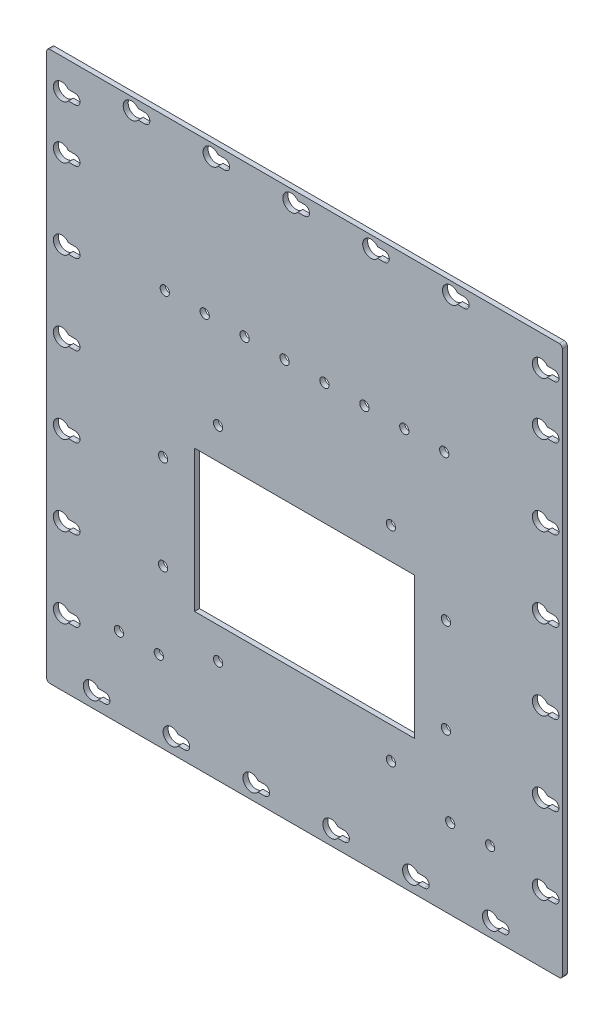
from build123d import *

# Parameters (mm, degrees)
SKETCH1_W                = 164.1
SKETCH1_H                = 174.745
BOSS_EXTRUDE1_DEPTH      = 1.5875
FILLET1_R                = 1
SKETCH2_R                = 1.4732
CUT_EXTRUDE1_DEPTH       = 10
HEAT_STRAP_CONNECTIONS_R = 1.4732
CUT_EXTRUDE2_DEPTH       = 241.065605994


with BuildPart() as part:
    # Sketch1 → Boss-Extrude1 (new body)
    with BuildSketch(Plane.XY):
        with Locations((82.55, -87.3725)):
            Rectangle(SKETCH1_W, SKETCH1_H)
        with BuildLine():
            Line((82.55, -5.4375), (80.434372699, -5.4375))
            ThreePointArc((80.434372699, -5.4375), (75.6625, -3.85), (80.434372699, -2.2625))
            Line((80.434372699, -2.2625), (82.55, -2.2625))
            ThreePointArc((82.55, -2.2625), (84.1375, -3.85), (82.55, -5.4375))
        make_face(mode=Mode.SUBTRACT)
        with BuildLine():
            Line((16.934372699, -168.395), (19.05, -168.395))
            ThreePointArc((19.05, -168.395), (20.6375, -169.9825), (19.05, -171.57))
            Line((19.05, -171.57), (16.934372699, -171.57))
            ThreePointArc((16.934372699, -171.57), (12.1625, -169.9825), (16.934372699, -168.395))
        make_face(mode=Mode.SUBTRACT)
        with BuildLine():
            Line((7.409372699, -151.9325), (9.525, -151.9325))
            ThreePointArc((9.525, -151.9325), (11.1125, -153.52), (9.525, -155.1075))
            Line((9.525, -155.1075), (7.409372699, -155.1075))
            ThreePointArc((7.409372699, -155.1075), (2.6375, -153.52), (7.409372699, -151.9325))
        make_face(mode=Mode.SUBTRACT)
        with BuildLine():
            Line((42.334372699, -168.395), (44.45, -168.395))
            ThreePointArc((44.45, -168.395), (46.0375, -169.9825), (44.45, -171.57))
            Line((44.45, -171.57), (42.334372699, -171.57))
            ThreePointArc((42.334372699, -171.57), (37.5625, -169.9825), (42.334372699, -168.395))
        make_face(mode=Mode.SUBTRACT)
        with BuildLine():
            Line((67.734372699, -168.395), (69.85, -168.395))
            ThreePointArc((69.85, -168.395), (71.4375, -169.9825), (69.85, -171.57))
            Line((69.85, -171.57), (67.734372699, -171.57))
            ThreePointArc((67.734372699, -171.57), (62.9625, -169.9825), (67.734372699, -168.395))
        make_face(mode=Mode.SUBTRACT)
        with BuildLine():
            Line((7.409372699, -126.5325), (9.525, -126.5325))
            ThreePointArc((9.525, -126.5325), (11.1125, -128.12), (9.525, -129.7075))
            Line((9.525, -129.7075), (7.409372699, -129.7075))
            ThreePointArc((7.409372699, -129.7075), (2.6375, -128.12), (7.409372699, -126.5325))
        make_face(mode=Mode.SUBTRACT)
        with BuildLine():
            Line((7.409372699, -101.1325), (9.525, -101.1325))
            ThreePointArc((9.525, -101.1325), (11.1125, -102.72), (9.525, -104.3075))
            Line((9.525, -104.3075), (7.409372699, -104.3075))
            ThreePointArc((7.409372699, -104.3075), (2.6375, -102.72), (7.409372699, -101.1325))
        make_face(mode=Mode.SUBTRACT)
        with BuildLine():
            Line((7.409372699, -75.7325), (9.525, -75.7325))
            ThreePointArc((9.525, -75.7325), (11.1125, -77.32), (9.525, -78.9075))
            Line((9.525, -78.9075), (7.409372699, -78.9075))
            ThreePointArc((7.409372699, -78.9075), (2.6375, -77.32), (7.409372699, -75.7325))
        make_face(mode=Mode.SUBTRACT)
        with BuildLine():
            Line((7.409372699, -50.3325), (9.525, -50.3325))
            ThreePointArc((9.525, -50.3325), (11.1125, -51.92), (9.525, -53.5075))
            Line((9.525, -53.5075), (7.409372699, -53.5075))
            ThreePointArc((7.409372699, -53.5075), (2.6375, -51.92), (7.409372699, -50.3325))
        make_face(mode=Mode.SUBTRACT)
        with BuildLine():
            Line((7.409372699, -24.9325), (9.525, -24.9325))
            ThreePointArc((9.525, -24.9325), (11.1125, -26.52), (9.525, -28.1075))
            Line((9.525, -28.1075), (7.409372699, -28.1075))
            ThreePointArc((7.409372699, -28.1075), (2.6375, -26.52), (7.409372699, -24.9325))
        make_face(mode=Mode.SUBTRACT)
        with BuildLine():
            Line((7.409372699, -8.1), (9.525, -8.1))
            ThreePointArc((9.525, -8.1), (11.1125, -9.6875), (9.525, -11.275))
            Line((9.525, -11.275), (7.409372699, -11.275))
            ThreePointArc((7.409372699, -11.275), (2.6375, -9.6875), (7.409372699, -8.1))
        make_face(mode=Mode.SUBTRACT)
        with BuildLine():
            Line((29.634372699, -2.2625), (31.75, -2.2625))
            ThreePointArc((31.75, -2.2625), (33.3375, -3.85), (31.75, -5.4375))
            Line((31.75, -5.4375), (29.634372699, -5.4375))
            ThreePointArc((29.634372699, -5.4375), (24.8625, -3.85), (29.634372699, -2.2625))
        make_face(mode=Mode.SUBTRACT)
        with BuildLine():
            Line((55.034372699, -2.2625), (57.15, -2.2625))
            ThreePointArc((57.15, -2.2625), (58.7375, -3.85), (57.15, -5.4375))
            Line((57.15, -5.4375), (55.034372699, -5.4375))
            ThreePointArc((55.034372699, -5.4375), (50.2625, -3.85), (55.034372699, -2.2625))
        make_face(mode=Mode.SUBTRACT)
        with BuildLine():
            ThreePointArc((161.925, -8.1), (163.5125, -9.6875), (161.925, -11.275))
            Line((161.925, -11.275), (159.809372699, -11.275))
            ThreePointArc((159.809372699, -11.275), (155.0375, -9.6875), (159.809372699, -8.1))
            Line((159.809372699, -8.1), (161.925, -8.1))
        make_face(mode=Mode.SUBTRACT)
        with BuildLine():
            Line((93.134372699, -168.395), (95.25, -168.395))
            ThreePointArc((95.25, -168.395), (96.8375, -169.9825), (95.25, -171.57))
            Line((95.25, -171.57), (93.134372699, -171.57))
            ThreePointArc((93.134372699, -171.57), (88.3625, -169.9825), (93.134372699, -168.395))
        make_face(mode=Mode.SUBTRACT)
        with BuildLine():
            Line((118.534372699, -168.395), (120.65, -168.395))
            ThreePointArc((120.65, -168.395), (122.2375, -169.9825), (120.65, -171.57))
            Line((120.65, -171.57), (118.534372699, -171.57))
            ThreePointArc((118.534372699, -171.57), (113.7625, -169.9825), (118.534372699, -168.395))
        make_face(mode=Mode.SUBTRACT)
        with BuildLine():
            Line((143.934372699, -168.395), (146.05, -168.395))
            ThreePointArc((146.05, -168.395), (147.6375, -169.9825), (146.05, -171.57))
            Line((146.05, -171.57), (143.934372699, -171.57))
            ThreePointArc((143.934372699, -171.57), (139.1625, -169.9825), (143.934372699, -168.395))
        make_face(mode=Mode.SUBTRACT)
        with BuildLine():
            Line((159.809372699, -151.9325), (161.925, -151.9325))
            ThreePointArc((161.925, -151.9325), (163.5125, -153.52), (161.925, -155.1075))
            Line((161.925, -155.1075), (159.809372699, -155.1075))
            ThreePointArc((159.809372699, -155.1075), (155.0375, -153.52), (159.809372699, -151.9325))
        make_face(mode=Mode.SUBTRACT)
        with BuildLine():
            Line((159.809372699, -126.5325), (161.925, -126.5325))
            ThreePointArc((161.925, -126.5325), (163.5125, -128.12), (161.925, -129.7075))
            Line((161.925, -129.7075), (159.809372699, -129.7075))
            ThreePointArc((159.809372699, -129.7075), (155.0375, -128.12), (159.809372699, -126.5325))
        make_face(mode=Mode.SUBTRACT)
        with BuildLine():
            Line((159.809372699, -101.1325), (161.925, -101.1325))
            ThreePointArc((161.925, -101.1325), (163.5125, -102.72), (161.925, -104.3075))
            Line((161.925, -104.3075), (159.809372699, -104.3075))
            ThreePointArc((159.809372699, -104.3075), (155.0375, -102.72), (159.809372699, -101.1325))
        make_face(mode=Mode.SUBTRACT)
        with BuildLine():
            Line((159.809372699, -75.7325), (161.925, -75.7325))
            ThreePointArc((161.925, -75.7325), (163.5125, -77.32), (161.925, -78.9075))
            Line((161.925, -78.9075), (159.809372699, -78.9075))
            ThreePointArc((159.809372699, -78.9075), (155.0375, -77.32), (159.809372699, -75.7325))
        make_face(mode=Mode.SUBTRACT)
        with BuildLine():
            Line((159.809372699, -50.3325), (161.925, -50.3325))
            ThreePointArc((161.925, -50.3325), (163.5125, -51.92), (161.925, -53.5075))
            Line((161.925, -53.5075), (159.809372699, -53.5075))
            ThreePointArc((159.809372699, -53.5075), (155.0375, -51.92), (159.809372699, -50.3325))
        make_face(mode=Mode.SUBTRACT)
        with BuildLine():
            Line((105.834372699, -2.2625), (107.95, -2.2625))
            ThreePointArc((107.95, -2.2625), (109.5375, -3.85), (107.95, -5.4375))
            Line((107.95, -5.4375), (105.834372699, -5.4375))
            ThreePointArc((105.834372699, -5.4375), (101.0625, -3.85), (105.834372699, -2.2625))
        make_face(mode=Mode.SUBTRACT)
        with BuildLine():
            Line((159.809372699, -24.9325), (161.925, -24.9325))
            ThreePointArc((161.925, -24.9325), (163.5125, -26.52), (161.925, -28.1075))
            Line((161.925, -28.1075), (159.809372699, -28.1075))
            ThreePointArc((159.809372699, -28.1075), (155.0375, -26.52), (159.809372699, -24.9325))
        make_face(mode=Mode.SUBTRACT)
        with BuildLine():
            Line((131.234372699, -2.2625), (133.35, -2.2625))
            ThreePointArc((133.35, -2.2625), (134.9375, -3.85), (133.35, -5.4375))
            Line((133.35, -5.4375), (131.234372699, -5.4375))
            ThreePointArc((131.234372699, -5.4375), (126.4625, -3.85), (131.234372699, -2.2625))
        make_face(mode=Mode.SUBTRACT)
    extrude(amount=BOSS_EXTRUDE1_DEPTH)

    # Fillet1
    fillet1_edges = [part.edges().sort_by_distance(p)[0] for p in [
        (164.6, -174.745, 0.79375),
        (0.5, -174.745, 0.79375),
        (0.5, 0, 0.79375),
        (164.6, 0, 0.79375),
    ]]
    fillet(fillet1_edges, radius=FILLET1_R)

    # Sketch2 → Cut-Extrude1 (cut)
    with BuildSketch(Plane.XY.offset(1.5875)):
        Polygon((117.55, -86.8725), (47.55, -86.8725), (47.55, -126.8725), (47.55, -131.8725), (117.55, -131.8725), (117.55, -126.8725), align=None)
        with Locations((110.05, -76.8725)):
            Circle(SKETCH2_R)
        with Locations((37.55, -94.3725)):
            Circle(SKETCH2_R)
        with Locations((37.55, -124.3725)):
            Circle(SKETCH2_R)
        with Locations((110.05, -141.8725)):
            Circle(SKETCH2_R)
        with Locations((55.05, -141.8725)):
            Circle(SKETCH2_R)
        with Locations((55.05, -76.8725)):
            Circle(SKETCH2_R)
        with Locations((127.55, -94.3725)):
            Circle(SKETCH2_R)
        with Locations((127.55, -124.3725)):
            Circle(SKETCH2_R)
    extrude(amount=-CUT_EXTRUDE1_DEPTH, mode=Mode.SUBTRACT)

    # Heat Strap Connections → Cut-Extrude2 (cut, through all)
    with BuildSketch(Plane.XY.offset(1.5875)):
        with Locations((38.1, -48.175)):
            Circle(HEAT_STRAP_CONNECTIONS_R)
        with Locations((50.8, -48.175)):
            Circle(HEAT_STRAP_CONNECTIONS_R)
        with Locations((63.5, -48.175)):
            Circle(HEAT_STRAP_CONNECTIONS_R)
        with Locations((76.2, -48.175)):
            Circle(HEAT_STRAP_CONNECTIONS_R)
        with Locations((88.9, -48.175)):
            Circle(HEAT_STRAP_CONNECTIONS_R)
        with Locations((101.6, -48.175)):
            Circle(HEAT_STRAP_CONNECTIONS_R)
        with Locations((114.3, -48.175)):
            Circle(HEAT_STRAP_CONNECTIONS_R)
        with Locations((127, -48.175)):
            Circle(HEAT_STRAP_CONNECTIONS_R)
        with Locations((23.5, -149.3975)):
            Circle(HEAT_STRAP_CONNECTIONS_R)
        with Locations((141.6, -149.3975)):
            Circle(HEAT_STRAP_CONNECTIONS_R)
        with Locations((36.2, -149.3975)):
            Circle(HEAT_STRAP_CONNECTIONS_R)
        with Locations((128.9, -149.3975)):
            Circle(HEAT_STRAP_CONNECTIONS_R)
    extrude(amount=-CUT_EXTRUDE2_DEPTH, mode=Mode.SUBTRACT)


solid = part.part
